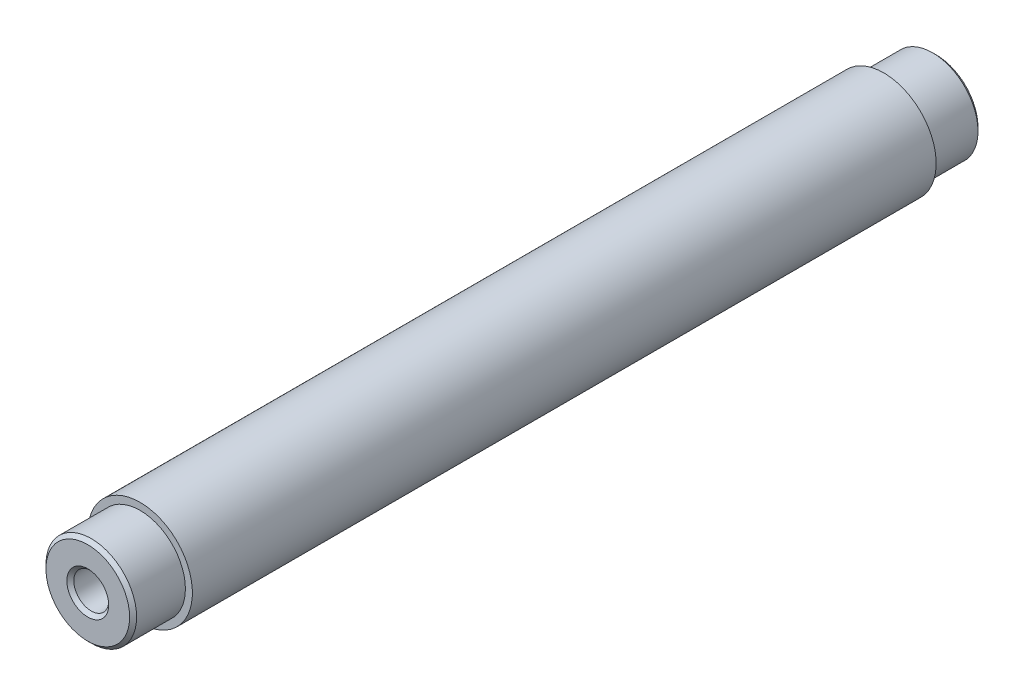
from build123d import *

# Parameters (mm, degrees)
ESBO_O1_R                = 7.5
RESSALTO_EXTRUS_O1_DEPTH = 60.825
CORTE_EXTRUS_O1_START    = -7.5
ESBO_O2_R                = 7.5
ESBO_O2_R_2              = 6.5
CORTE_EXTRUS_O1_DEPTH    = 7.5
CHANFRO1_SIZE            = 0.5


with BuildPart() as part:
    # Esboço1 → Ressalto-extrusão1 (new, symmetric)
    with BuildSketch(Plane.XY):
        with Locations(Location((0, 0, 0), (0, 0, 180))):
            Circle(ESBO_O1_R)
    extrude(amount=RESSALTO_EXTRUS_O1_DEPTH, both=True)

    # Esboço2 → Corte-extrusão1 (cut)
    with BuildSketch(Plane(origin=(0, 0, -60.825), x_dir=(-1, 0, 0), z_dir=(0, 0, -1)).offset(CORTE_EXTRUS_O1_START)):
        Circle(ESBO_O2_R)
        Circle(ESBO_O2_R_2, mode=Mode.SUBTRACT)
    corte_extrus_o1 = extrude(amount=CORTE_EXTRUS_O1_DEPTH, mode=Mode.SUBTRACT)

    # Esboço7 → Furo roscado de M6x1.01 (revolve, cut)
    with BuildSketch(Plane(origin=(0, 0, -60.825), x_dir=(0, 1, 0), z_dir=(1, 0, 0))):
        Polygon((0, 0), (0, 17), (2.5, 15.497848452), (2.5, 0), align=None)
    furo_roscado_de_m6x1_01 = revolve(axis=Axis((0, 0, -67.175), (0, 0, 1)), mode=Mode.SUBTRACT)

    # Espelhar1: Corte-extrusão1, Furo roscado de M6x1.01 across plane
    add(corte_extrus_o1.mirror(Plane.XY), mode=Mode.SUBTRACT)
    add(furo_roscado_de_m6x1_01.mirror(Plane.XY), mode=Mode.SUBTRACT)

    # Chanfro1
    chanfro1_edges = [part.edges().sort_by_distance(p)[0] for p in [
        (0, -2.5, -60.825),
        (6.5, 0, 60.825),
        (0, -2.5, 60.825),
        (6.5, 0, -60.825),
    ]]
    chamfer(chanfro1_edges, length=CHANFRO1_SIZE)


solid = part.part
